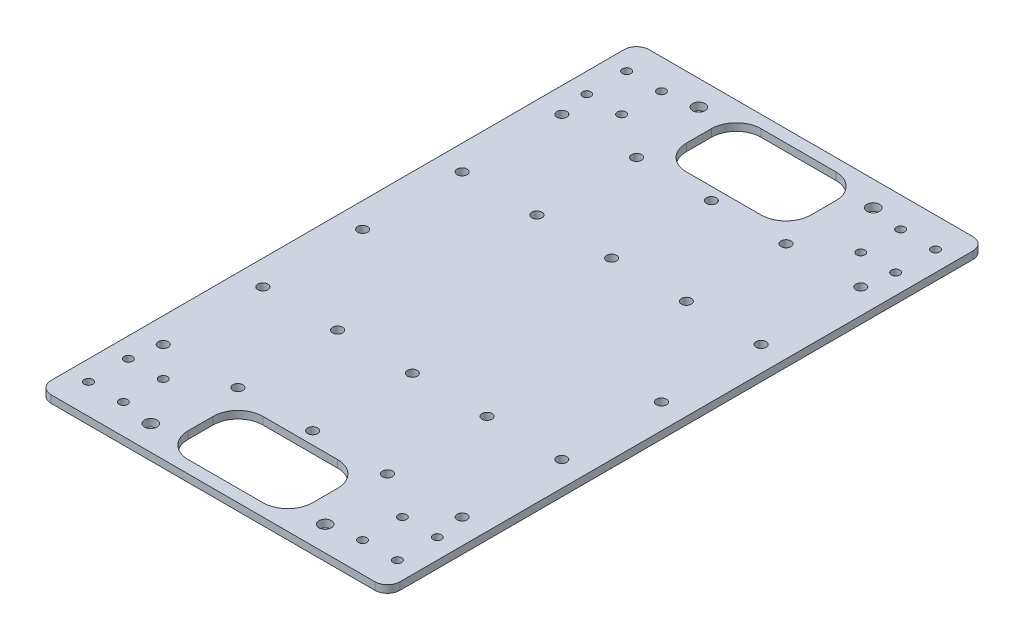
from build123d import *

# Parameters (mm, degrees)
SKETCH_1_R          = 1.7
SKETCH_1_R_2        = 2.5
EXTRUDE_1_DEPTH     = 3
SKETCH_2_R          = 2
CUT_EXTRUDE_1_DEPTH = 3


with BuildPart() as part:
    # 草图1 → 凸台-拉伸1 (new body)
    with BuildSketch(Plane(origin=(0, 0, 0), x_dir=(1, 0, 0), z_dir=(0, 1, 0))):
        with BuildLine():
            ThreePointArc((-65, 120), (-68.535533906, 118.535533906), (-70, 115))
            Line((-70, 115), (-70, -115))
            ThreePointArc((-70, -115), (-68.535533906, -118.535533906), (-65, -120))
            Line((-65, -120), (65, -120))
            ThreePointArc((65, -120), (68.535533906, -118.535533906), (70, -115))
            Line((70, -115), (70, 115))
            ThreePointArc((70, 115), (68.535533906, 118.535533906), (65, 120))
            Line((65, 120), (-65, 120))
        make_face()
        with BuildLine():
            Line((-25, 95), (-25, 105))
            ThreePointArc((-25, 105), (-22.071067812, 112.071067812), (-15, 115))
            Line((-15, 115), (15, 115))
            ThreePointArc((15, 115), (22.071067812, 112.071067812), (25, 105))
            Line((25, 105), (25, 95))
            ThreePointArc((25, 95), (22.071067812, 87.928932188), (15, 85))
            Line((15, 85), (-15, 85))
            ThreePointArc((-15, 85), (-22.071067812, 87.928932188), (-25, 95))
        make_face(mode=Mode.SUBTRACT)
        with Locations(Location((-48, 92, 0), (0, 0, 270))):
            Circle(SKETCH_1_R, mode=Mode.SUBTRACT)
        with Locations(Location((-62, 92, 0), (0, 0, 270))):
            Circle(SKETCH_1_R, mode=Mode.SUBTRACT)
        with Locations(Location((-35, 110, 0), (0, 0, 270))):
            Circle(SKETCH_1_R_2, mode=Mode.SUBTRACT)
        with Locations(Location((-48, 108, 0), (0, 0, 270))):
            Circle(SKETCH_1_R, mode=Mode.SUBTRACT)
        with Locations(Location((-62, 108, 0), (0, 0, 270))):
            Circle(SKETCH_1_R, mode=Mode.SUBTRACT)
        with Locations(Location((35, 110, 0), (0, 0, 270))):
            Circle(SKETCH_1_R_2, mode=Mode.SUBTRACT)
        with Locations(Location((62, 108, 0), (0, 0, 270))):
            Circle(SKETCH_1_R, mode=Mode.SUBTRACT)
        with Locations(Location((62, 92, 0), (0, 0, 270))):
            Circle(SKETCH_1_R, mode=Mode.SUBTRACT)
        with Locations(Location((48, 108, 0), (0, 0, 270))):
            Circle(SKETCH_1_R, mode=Mode.SUBTRACT)
        with Locations(Location((-62, -108, 0), (0, 0, 270))):
            Circle(SKETCH_1_R, mode=Mode.SUBTRACT)
        with Locations(Location((-62, -92, 0), (0, 0, 270))):
            Circle(SKETCH_1_R, mode=Mode.SUBTRACT)
        with Locations(Location((-48, -108, 0), (0, 0, 270))):
            Circle(SKETCH_1_R, mode=Mode.SUBTRACT)
        with Locations(Location((-35, -110, 0), (0, 0, 270))):
            Circle(SKETCH_1_R_2, mode=Mode.SUBTRACT)
        with Locations(Location((-48, -92, 0), (0, 0, 270))):
            Circle(SKETCH_1_R, mode=Mode.SUBTRACT)
        with BuildLine():
            ThreePointArc((15, -85), (22.071067812, -87.928932188), (25, -95))
            Line((25, -95), (25, -105))
            ThreePointArc((25, -105), (22.071067812, -112.071067812), (15, -115))
            Line((15, -115), (-15, -115))
            ThreePointArc((-15, -115), (-22.071067812, -112.071067812), (-25, -105))
            Line((-25, -105), (-25, -95))
            ThreePointArc((-25, -95), (-22.071067812, -87.928932188), (-15, -85))
            Line((-15, -85), (15, -85))
        make_face(mode=Mode.SUBTRACT)
        with Locations(Location((35, -110, 0), (0, 0, 270))):
            Circle(SKETCH_1_R_2, mode=Mode.SUBTRACT)
        with Locations(Location((48, -108, 0), (0, 0, 270))):
            Circle(SKETCH_1_R, mode=Mode.SUBTRACT)
        with Locations(Location((48, -92, 0), (0, 0, 270))):
            Circle(SKETCH_1_R, mode=Mode.SUBTRACT)
        with Locations(Location((62, -108, 0), (0, 0, 270))):
            Circle(SKETCH_1_R, mode=Mode.SUBTRACT)
        with Locations(Location((62, -92, 0), (0, 0, 270))):
            Circle(SKETCH_1_R, mode=Mode.SUBTRACT)
        with Locations(Location((48, 92, 0), (0, 0, 270))):
            Circle(SKETCH_1_R, mode=Mode.SUBTRACT)
    extrude(amount=EXTRUDE_1_DEPTH)

    # 草图2 → 切除-拉伸1 (cut)
    with BuildSketch(Plane(origin=(0, 3, 0), x_dir=(1, 0, 0), z_dir=(0, 1, 0))):
        with Locations(Location((-60, 0, 0), (0, 0, 270))):
            Circle(SKETCH_2_R)
        with Locations(Location((-60, 40, 0), (0, 0, 270))):
            Circle(SKETCH_2_R)
        with Locations(Location((-60, 80, 0), (0, 0, 270))):
            Circle(SKETCH_2_R)
        with Locations(Location((-60, -80, 0), (0, 0, 270))):
            Circle(SKETCH_2_R)
        with Locations(Location((-60, -40, 0), (0, 0, 270))):
            Circle(SKETCH_2_R)
        with Locations(Location((-30, 40, 0), (0, 0, 270))):
            Circle(SKETCH_2_R)
        with Locations(Location((-30, 80, 0), (0, 0, 270))):
            Circle(SKETCH_2_R)
        with Locations(Location((-30, -40, 0), (0, 0, 270))):
            Circle(SKETCH_2_R)
        with Locations(Location((-30, -80, 0), (0, 0, 270))):
            Circle(SKETCH_2_R)
        with Locations(Location((30, -80, 0), (0, 0, 270))):
            Circle(SKETCH_2_R)
        with Locations(Location((30, -40, 0), (0, 0, 270))):
            Circle(SKETCH_2_R)
        with Locations(Location((30, 80, 0), (0, 0, 270))):
            Circle(SKETCH_2_R)
        with Locations(Location((30, 40, 0), (0, 0, 270))):
            Circle(SKETCH_2_R)
        with Locations(Location((60, -40, 0), (0, 0, 270))):
            Circle(SKETCH_2_R)
        with Locations(Location((60, -80, 0), (0, 0, 270))):
            Circle(SKETCH_2_R)
        with Locations(Location((60, 80, 0), (0, 0, 270))):
            Circle(SKETCH_2_R)
        with Locations(Location((60, 40, 0), (0, 0, 270))):
            Circle(SKETCH_2_R)
        with Locations(Location((60, 0, 0), (0, 0, 270))):
            Circle(SKETCH_2_R)
        with Locations(Location((0, -40, 0), (0, 0, 270))):
            Circle(SKETCH_2_R)
        with Locations(Location((0, -80, 0), (0, 0, 270))):
            Circle(SKETCH_2_R)
        with Locations(Location((0, 80, 0), (0, 0, 270))):
            Circle(SKETCH_2_R)
        with Locations(Location((0, 40, 0), (0, 0, 90))):
            Circle(SKETCH_2_R)
    extrude(amount=-CUT_EXTRUDE_1_DEPTH, mode=Mode.SUBTRACT)


solid = part.part
